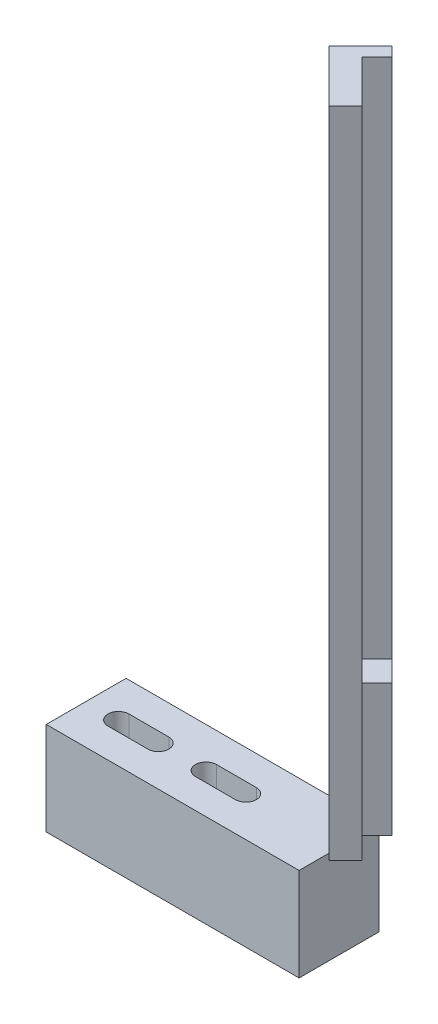
from build123d import *

# Parameters (mm, degrees)
SKETCH1_W                             = 48.26
SKETCH1_H                             = 17.78
BOSS_EXTRUDE1_DEPTH                   = 15.24
CUT_EXTRUDE2_DEPTH                    = 54.641528688
BOSS_EXTRUDE2_DEPTH                   = 124.7199944
BOSS_EXTRUDE4_DEPTH                   = 18.21999912
BOSS_EXTRUDE5_DEPTH                   = 25.2199902
F_1_5MM_DOWEL_HOLE1_D                 = 1.5
TAPPED_HOLE_FOR_M2_5X0_45_HELICOIL1_D = 2.55


with BuildPart() as part:
    # Sketch1 → Boss-Extrude1 (new body)
    with BuildSketch(Plane.XY):
        with Locations((24.13, 8.89)):
            Rectangle(SKETCH1_W, SKETCH1_H)
    extrude(amount=-BOSS_EXTRUDE1_DEPTH)

    # Sketch4 → Cut-Extrude2 (cut, through all)
    with BuildSketch(Plane(origin=(0, 17.78, 0), x_dir=(1, 0, 0), z_dir=(0, 1, 0))):
        with BuildLine():
            Line((30.48, 5.62), (22.86, 5.62))
            ThreePointArc((22.86, 5.62), (20.86, 7.62), (22.86, 9.62))
            Line((22.86, 9.62), (30.48, 9.62))
            ThreePointArc((30.48, 9.62), (32.48, 7.62), (30.48, 5.62))
        make_face()
        with BuildLine():
            Line((13.78, 5.62), (6.16, 5.62))
            ThreePointArc((6.16, 5.62), (4.16, 7.62), (6.16, 9.62))
            Line((6.16, 9.62), (13.78, 9.62))
            ThreePointArc((13.78, 9.62), (15.78, 7.62), (13.78, 5.62))
        make_face()
    extrude(amount=-CUT_EXTRUDE2_DEPTH, mode=Mode.SUBTRACT)

    # Sketch3 → Boss-Extrude2 (add)
    with BuildSketch(Plane(origin=(0, 17.78, 0), x_dir=(1, 0, 0), z_dir=(0, 1, 0))):
        Polygon((52.660828417, 7.619998743), (48.488883403, 11.791943757), (44.529097479, 15.751729681), (47.357520181, 18.580152383), (45.561468957, 20.376203607), (40.42526535, 15.24), (39.573657012, 14.388391662), (49.501439174, 4.4606095), align=None)
    extrude(amount=BOSS_EXTRUDE2_DEPTH)

    # Sketch3<7> → Boss-Extrude4 (add)
    with BuildSketch(Plane(origin=(0, 17.78, 0), x_dir=(1, 0, 0), z_dir=(0, 1, 0))):
        Polygon((39.573657012, 14.388391662), (40.42526535, 15.24), (45.561468957, 20.376203607), (47.357520181, 18.580152383), (44.529097479, 15.751729681), (52.660828417, 7.619998743), (49.501439174, 4.4606095), align=None)
    extrude(amount=BOSS_EXTRUDE4_DEPTH)

    # Sketch3<8> → Boss-Extrude5 (add)
    with BuildSketch(Plane(origin=(0, 17.78, 0), x_dir=(1, 0, 0), z_dir=(0, 1, 0))):
        Polygon((44.529097479, 15.751729681), (48.488883403, 11.791943757), (51.317306105, 14.620366459), (47.357520181, 18.580152383), align=None)
    extrude(amount=BOSS_EXTRUDE5_DEPTH)

    # Ø1.5mm Dowel Hole1 (through all)
    with Locations(Plane(origin=(30.14041358, 0, -30.14041358), x_dir=(-0.707106781186544, 0, -0.7071067811865511), z_dir=(0.7071067811865511, 0, -0.707106781186544))):
        with Locations((-25.348661915, 56.6999882)):
            Hole(F_1_5MM_DOWEL_HOLE1_D / 2)

    # Tapped Hole for M2.5x0.45 Helicoil1 (through all)
    with Locations(Plane(origin=(30.14041358, 0, -30.14041358), x_dir=(-0.7071067811865478, 0, -0.7071067811865472), z_dir=(0.7071067811865472, 0, -0.7071067811865478))):
        with Locations((-28.898667515, 56.6999882), (-28.898667515, 126.6998482)):
            Hole(TAPPED_HOLE_FOR_M2_5X0_45_HELICOIL1_D / 2)


solid = part.part
